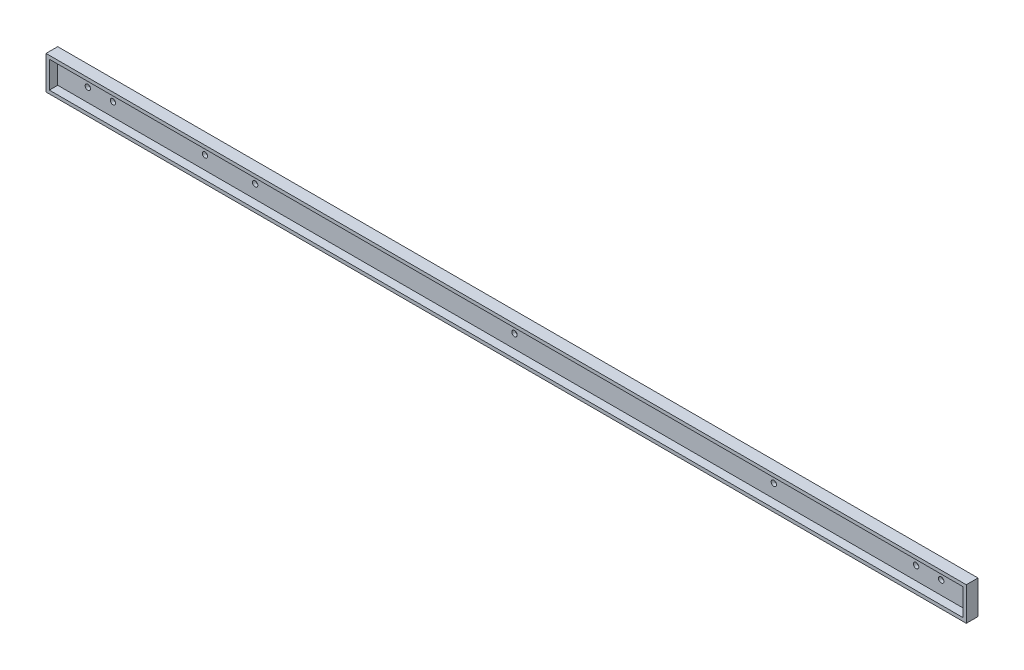
from build123d import *

# Parameters (mm, degrees)
SKETCH_1_W          = 550
SKETCH_1_H          = 20
EXTRUDE_1_DEPTH     = 7
SKETCH_2_W          = 546
SKETCH_2_H          = 16
CUT_EXTRUDE_1_DEPTH = 5
SKETCH_3_R          = 1.6
CUT_EXTRUDE_2_DEPTH = 276.270775783
SKETCH_4_R          = 1.6
CUT_EXTRUDE_3_DEPTH = 276.270775783


with BuildPart() as part:
    # ｽｹｯﾁ1 → ﾎﾞｽ - 押し出し1 (new body)
    with BuildSketch(Plane.XY):
        Rectangle(SKETCH_1_W, SKETCH_1_H)
    extrude(amount=EXTRUDE_1_DEPTH)

    # ｽｹｯﾁ2 → ｶｯﾄ - 押し出し1 (cut)
    with BuildSketch(Plane.XY.offset(7)):
        Rectangle(SKETCH_2_W, SKETCH_2_H)
    extrude(amount=-CUT_EXTRUDE_1_DEPTH, mode=Mode.SUBTRACT)

    # ｽｹｯﾁ3 → ｶｯﾄ - 押し出し2 (cut, through all)
    with BuildSketch(Plane(origin=(0, 0, 0), x_dir=(-1, 0, 0), z_dir=(0, 0, -1))):
        with Locations((255, 0)):
            Circle(SKETCH_3_R)
        with Locations((240, 0)):
            Circle(SKETCH_3_R)
        with Locations((155, 0)):
            Circle(SKETCH_3_R)
        Circle(SKETCH_3_R)
        with Locations(Location((-255, 0, 0), (0, 0, 180))):
            Circle(SKETCH_3_R)
        with Locations(Location((-240, 0, 0), (0, 0, 180))):
            Circle(SKETCH_3_R)
        with Locations(Location((-155, 0, 0), (0, 0, 180))):
            Circle(SKETCH_3_R)
    extrude(amount=-CUT_EXTRUDE_2_DEPTH, mode=Mode.SUBTRACT)

    # ｽｹｯﾁ4 → ｶｯﾄ - 押し出し3 (cut, through all)
    with BuildSketch(Plane(origin=(0, 0, 0), x_dir=(-1, 0, 0), z_dir=(0, 0, -1))):
        with Locations((185, 0)):
            Circle(SKETCH_4_R)
    extrude(amount=-CUT_EXTRUDE_3_DEPTH, mode=Mode.SUBTRACT)


solid = part.part
